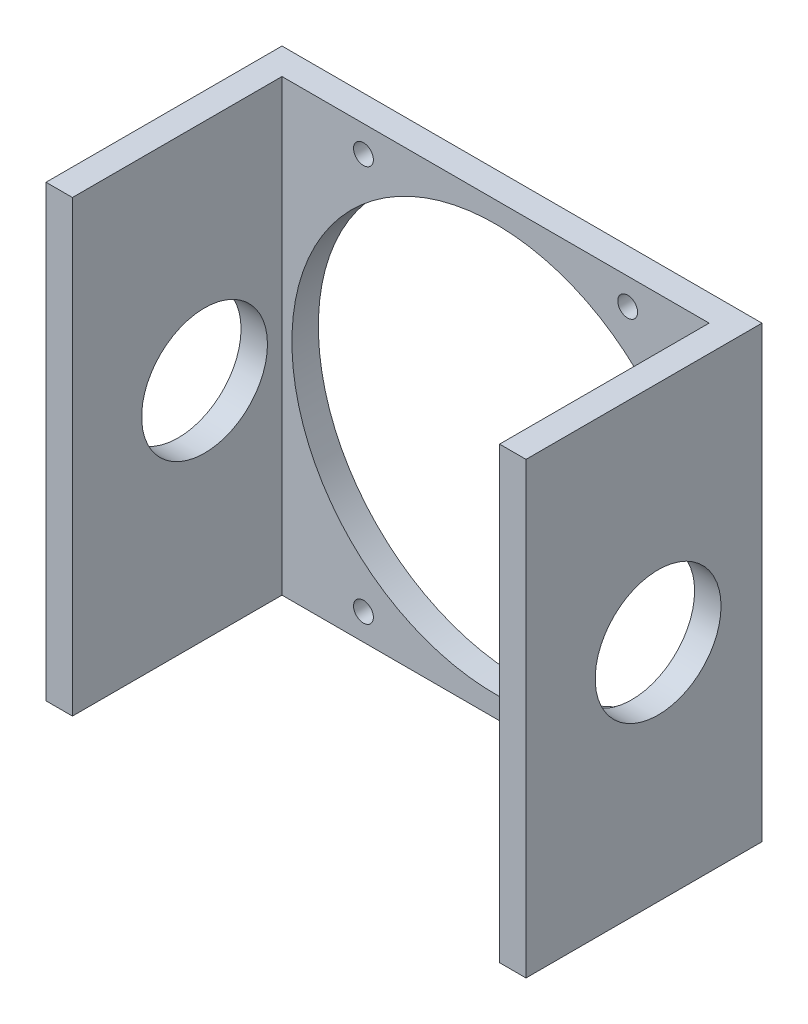
from build123d import *

# Parameters (mm, degrees)
BOSS_EXTRUDE2_DEPTH      = 51
BOSS_EXTRUDE2_DEPTH_BACK = 51
SKETCH4_R                = 46.25
SKETCH4_R_2              = 2.25
CUT_EXTRUDE1_DEPTH       = 89.519630491
SKETCH5_R                = 14.2875
CUT_EXTRUDE2_DEPTH       = 125.024191189


with BuildPart() as part:
    # Sketch3 → Boss-Extrude2 (new, two sides: drawn at the far end of the back side and taken through both)
    with BuildSketch(Plane(origin=(0, 0, 0), x_dir=(1, 0, 0), z_dir=(0, 1, 0)).offset(-BOSS_EXTRUDE2_DEPTH_BACK)):
        Polygon((-48.5, -30), (-54.5, -30), (-54.5, 23.5865), (54.5, 23.5865), (54.5, -30), (48.5, -30), (48.5, 17.5865), (-48.5, 17.5865), align=None)
    extrude(amount=BOSS_EXTRUDE2_DEPTH + BOSS_EXTRUDE2_DEPTH_BACK)

    # Sketch4 → Cut-Extrude1 (cut, through all)
    with BuildSketch(Plane.XY.offset(-17.5865)):
        Circle(SKETCH4_R)
        with Locations((-30, 45)):
            Circle(SKETCH4_R_2)
        with Locations((30, 45)):
            Circle(SKETCH4_R_2)
        with Locations((30, -45)):
            Circle(SKETCH4_R_2)
        with Locations((-30, -45)):
            Circle(SKETCH4_R_2)
    extrude(amount=-CUT_EXTRUDE1_DEPTH, mode=Mode.SUBTRACT)

    # Sketch5 → Cut-Extrude2 (cut, through all)
    with BuildSketch(Plane(origin=(54.5, 0, 0), x_dir=(0, 0, -1), z_dir=(1, 0, 0))):
        Circle(SKETCH5_R)
    extrude(amount=-CUT_EXTRUDE2_DEPTH, mode=Mode.SUBTRACT)


solid = part.part
